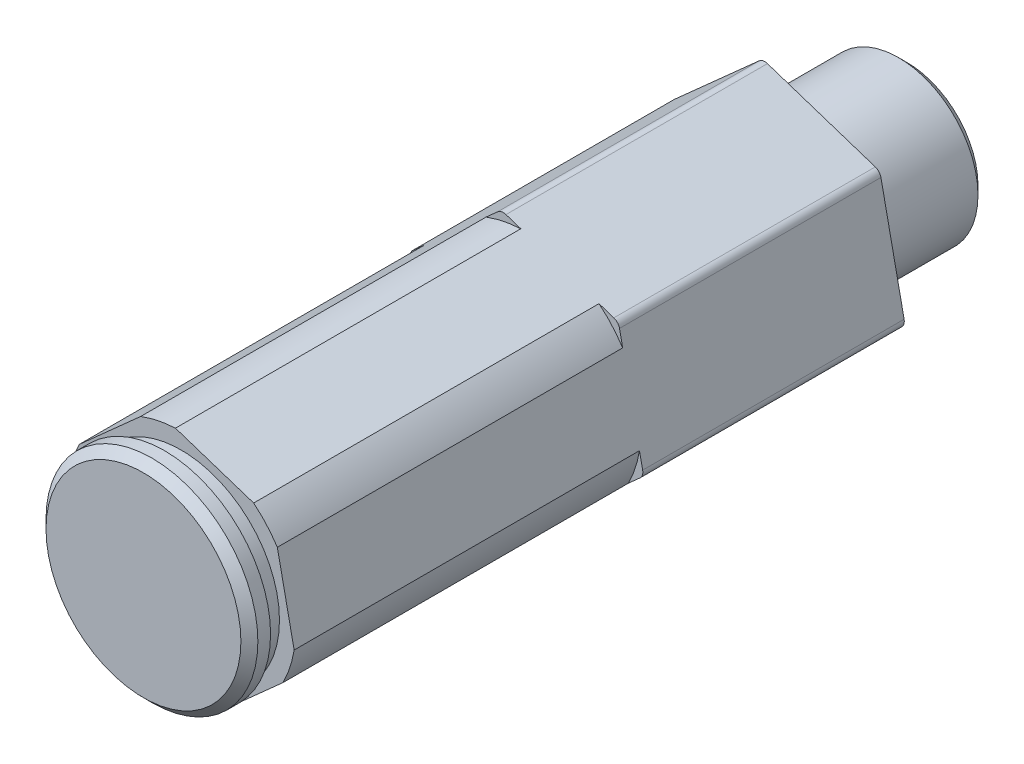
from build123d import *

# Parameters (mm, degrees)
SKETCH3_OUTSIDE_W   = 25.668
SKETCH3_OUTSIDE_H   = 25.668
CUT_EXTRUDE1_DEPTH  = 47.788336733
CHAMFER1_SIZE       = 0.508
BOSS_EXTRUDE1_DEPTH = 15.6718
FILLET1_R           = 0.508


with BuildPart() as part:
    # Sketch2 → Revolve1 (revolve)
    with BuildSketch(Plane(origin=(0, 0, 0), x_dir=(0, 0, -1), z_dir=(1, 0, 0)), mode=Mode.PRIVATE) as revolve1_sk:
        Polygon((-22.8854, 6.35), (-22.8854, 0), (22.8854, 0), (22.8854, 4.7625), (15.748, 4.7625), (15.748, 6.862299966), (-20.6248, 6.862299966), (-20.6248, 5.8928), (-21.6154, 5.8928), (-21.6154, 6.35), align=None)
    revolve(revolve1_sk.sketch.rotate(Axis((0, 0, 6.497503614), (0, 0, -1)), 90), axis=Axis((0, 0, 6.497503614), (0, 0, -1)))

    # Sketch3 outside → Cut-Extrude1 (cut, through all)
    with BuildSketch(Plane.XY.offset(22.8854)):
        Rectangle(SKETCH3_OUTSIDE_W, SKETCH3_OUTSIDE_H)
        Polygon((1.509607841, -7.238192802), (7.023262765, -2.311737661), (5.513654923, 4.926455141), (-1.509607841, 7.238192802), (-7.023262765, 2.311737661), (-5.513654923, -4.926455141), align=None, mode=Mode.SUBTRACT)
    extrude(amount=-CUT_EXTRUDE1_DEPTH, mode=Mode.SUBTRACT)

    # Chamfer1
    chamfer1_edges = [part.edges().sort_by_distance(p)[0] for p in [
        (-6.35, 0, 22.8854),
        (-4.7625, 0, -22.8854),
    ]]
    chamfer(chamfer1_edges, length=CHAMFER1_SIZE)

    # Sketch4 → Boss-Extrude1 (add)
    with BuildSketch(Plane(origin=(0, 0, -15.748), x_dir=(-1, 0, 0), z_dir=(0, 0, -1))):
        Polygon((-1.509607841, -7.238192802), (5.513654923, -4.926455141), (7.023262765, 2.311737661), (1.509607841, 7.238192802), (-5.513654923, 4.926455141), (-7.023262765, -2.311737661), align=None)
    extrude(amount=-BOSS_EXTRUDE1_DEPTH)

    # Fillet1
    fillet1_edges = [part.edges().sort_by_distance(p)[0] for p in [
        (1.509607841, -7.238192802, -7.9121),
        (7.023262765, -2.311737661, -7.9121),
        (5.513654923, 4.926455141, -7.9121),
        (-1.509607841, 7.238192802, -7.9121),
        (-7.023262765, 2.311737661, -7.9121),
        (-5.513654923, -4.926455141, -7.9121),
    ]]
    fillet(fillet1_edges, radius=FILLET1_R)


solid = part.part
